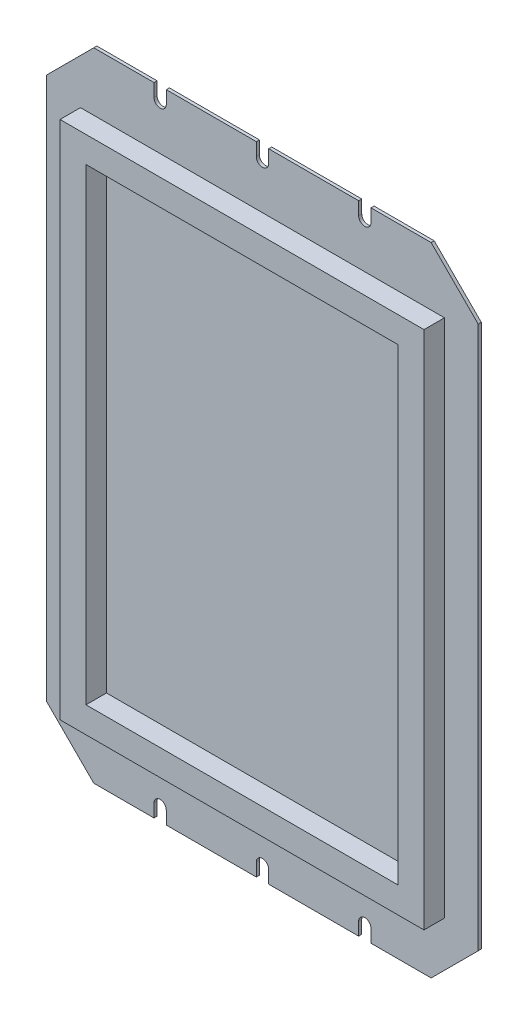
from build123d import *

# Parameters (mm, degrees)
BOSS_EXTRUDE1_DEPTH      = 0.75
BOSS_EXTRUDE1_DEPTH_BACK = 0.75
CUT_EXTRUDE1_DEPTH       = 188.923950642
LPATTERN1_COUNT          = 7
LPATTERN1_PITCH          = 50
MIRROR1_COPY_1_DEPTH     = 188.923950642
MIRROR1_COPY_2_DEPTH     = 188.923950642
MIRROR1_COPY_3_DEPTH     = 188.923950642
MIRROR1_COPY_4_DEPTH     = 188.923950642
MIRROR1_COPY_5_DEPTH     = 188.923950642
MIRROR1_COPY_6_DEPTH     = 188.923950642
SKETCH6_W                = 177.8
SKETCH6_H                = 254
SKETCH6_W_2              = 152.4
SKETCH6_H_2              = 228.6
BOSS_EXTRUDE2_DEPTH      = 11.5


with BuildPart() as part:
    # Sketch3 → Boss-Extrude1 (new, two sides: drawn at the far end of the back side and taken through both)
    with BuildSketch(Plane.XY.offset(-BOSS_EXTRUDE1_DEPTH_BACK)):
        Polygon((-105.41, 132.575), (-82.41, 155.575), (82.41, 155.575), (105.41, 132.575), (105.41, -132.575), (82.41, -155.575), (-82.41, -155.575), (-105.41, -132.575), align=None)
    extrude(amount=BOSS_EXTRUDE1_DEPTH + BOSS_EXTRUDE1_DEPTH_BACK)

    # Sketch4 → Cut-Extrude1 (cut, symmetric)
    with BuildSketch(Plane.XY):
        with BuildLine():
            Line((53, 149.225), (53, 155.575))
            Line((53, 155.575), (47, 155.575))
            Line((47, 155.575), (47, 149.225))
            ThreePointArc((47, 149.225), (50, 146.225), (53, 149.225))
        make_face()
    cut_extrude1 = extrude(amount=CUT_EXTRUDE1_DEPTH, both=True, mode=Mode.SUBTRACT)

    # LPattern1: Cut-Extrude1 ×7
    with Locations(*[(-i * LPATTERN1_PITCH, 0, 0) for i in range(1, LPATTERN1_COUNT)]):
        add(cut_extrude1, mode=Mode.SUBTRACT)

    # Mirror1: Cut-Extrude1 across plane
    add(cut_extrude1.mirror(Plane.ZX), mode=Mode.SUBTRACT)

    # Mirror1 copy 1 sketch → Mirror1 copy 1 (cut, symmetric)
    with BuildSketch(Plane(origin=(-50, 0, 0), x_dir=(1, 0, 0), z_dir=(0, 0, 1))):
        with BuildLine():
            Line((53, -149.225), (53, -155.575))
            Line((53, -155.575), (47, -155.575))
            Line((47, -155.575), (47, -149.225))
            ThreePointArc((47, -149.225), (50, -146.225), (53, -149.225))
        make_face()
    extrude(amount=MIRROR1_COPY_1_DEPTH, both=True, mode=Mode.SUBTRACT)

    # Mirror1 copy 2 sketch → Mirror1 copy 2 (cut, symmetric)
    with BuildSketch(Plane(origin=(-100, 0, 0), x_dir=(1, 0, 0), z_dir=(0, 0, 1))):
        with BuildLine():
            Line((53, -149.225), (53, -155.575))
            Line((53, -155.575), (47, -155.575))
            Line((47, -155.575), (47, -149.225))
            ThreePointArc((47, -149.225), (50, -146.225), (53, -149.225))
        make_face()
    extrude(amount=MIRROR1_COPY_2_DEPTH, both=True, mode=Mode.SUBTRACT)

    # Mirror1 copy 3 sketch → Mirror1 copy 3 (cut, symmetric)
    with BuildSketch(Plane(origin=(-150, 0, 0), x_dir=(1, 0, 0), z_dir=(0, 0, 1))):
        with BuildLine():
            Line((53, -149.225), (53, -155.575))
            Line((53, -155.575), (47, -155.575))
            Line((47, -155.575), (47, -149.225))
            ThreePointArc((47, -149.225), (50, -146.225), (53, -149.225))
        make_face()
    extrude(amount=MIRROR1_COPY_3_DEPTH, both=True, mode=Mode.SUBTRACT)

    # Mirror1 copy 4 sketch → Mirror1 copy 4 (cut, symmetric)
    with BuildSketch(Plane(origin=(-200, 0, 0), x_dir=(1, 0, 0), z_dir=(0, 0, 1))):
        with BuildLine():
            Line((53, -149.225), (53, -155.575))
            Line((53, -155.575), (47, -155.575))
            Line((47, -155.575), (47, -149.225))
            ThreePointArc((47, -149.225), (50, -146.225), (53, -149.225))
        make_face()
    extrude(amount=MIRROR1_COPY_4_DEPTH, both=True, mode=Mode.SUBTRACT)

    # Mirror1 copy 5 sketch → Mirror1 copy 5 (cut, symmetric)
    with BuildSketch(Plane(origin=(-250, 0, 0), x_dir=(1, 0, 0), z_dir=(0, 0, 1))):
        with BuildLine():
            Line((53, -149.225), (53, -155.575))
            Line((53, -155.575), (47, -155.575))
            Line((47, -155.575), (47, -149.225))
            ThreePointArc((47, -149.225), (50, -146.225), (53, -149.225))
        make_face()
    extrude(amount=MIRROR1_COPY_5_DEPTH, both=True, mode=Mode.SUBTRACT)

    # Mirror1 copy 6 sketch → Mirror1 copy 6 (cut, symmetric)
    with BuildSketch(Plane(origin=(-300, 0, 0), x_dir=(1, 0, 0), z_dir=(0, 0, 1))):
        with BuildLine():
            Line((53, -149.225), (53, -155.575))
            Line((53, -155.575), (47, -155.575))
            Line((47, -155.575), (47, -149.225))
            ThreePointArc((47, -149.225), (50, -146.225), (53, -149.225))
        make_face()
    extrude(amount=MIRROR1_COPY_6_DEPTH, both=True, mode=Mode.SUBTRACT)

    # Sketch6 → Boss-Extrude2 (add)
    with BuildSketch(Plane(origin=(0, 0, -0.75), x_dir=(-1, 0, 0), z_dir=(0, 0, -1))):
        Rectangle(SKETCH6_W, SKETCH6_H)
        Rectangle(SKETCH6_W_2, SKETCH6_H_2, mode=Mode.SUBTRACT)
    extrude(amount=-BOSS_EXTRUDE2_DEPTH)


solid = part.part
